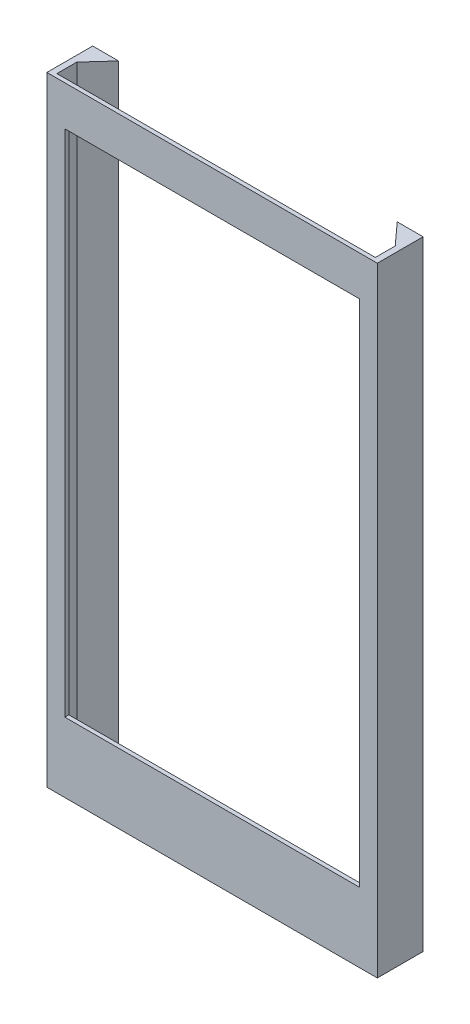
from build123d import *

# Parameters (mm, degrees)
CROQUIS1_W              = 74
CROQUIS1_H              = 128
SALIENTE_EXTRUIR1_DEPTH = 11.5
CROQUIS2_W              = 80
CROQUIS2_H              = 154
CORTAR_EXTRUIR1_DEPTH   = 10.5
SALIENTE_EXTRUIR3_DEPTH = 154


with BuildPart() as part:
    # Croquis1 → Saliente-Extruir1 (new body)
    with BuildSketch(Plane.XY):
        Polygon((-40, 77), (-41.5, 77), (-41.5, -78.5), (41.5, -78.5), (41.5, 77), (40, 77), align=None)
        with Locations((0, 3)):
            Rectangle(CROQUIS1_W, CROQUIS1_H, mode=Mode.SUBTRACT)
    extrude(amount=SALIENTE_EXTRUIR1_DEPTH)

    # Croquis2 → Cortar-Extruir1 (cut)
    with BuildSketch(Plane(origin=(0, 0, 0), x_dir=(-1, 0, 0), z_dir=(0, 0, -1))):
        Rectangle(CROQUIS2_W, CROQUIS2_H)
    extrude(amount=-CORTAR_EXTRUIR1_DEPTH, mode=Mode.SUBTRACT)

    # Croquis3 → Saliente-Extruir3 (add, through all)
    with BuildSketch(Plane(origin=(0, -77, 0), x_dir=(1, 0, 0), z_dir=(0, 1, 0))):
        Polygon((-40, -5.5), (-35, 0), (-40, 0), align=None)
        Polygon((40, 0), (40, -5.5), (35, 0), align=None)
    extrude(amount=SALIENTE_EXTRUIR3_DEPTH)


solid = part.part
